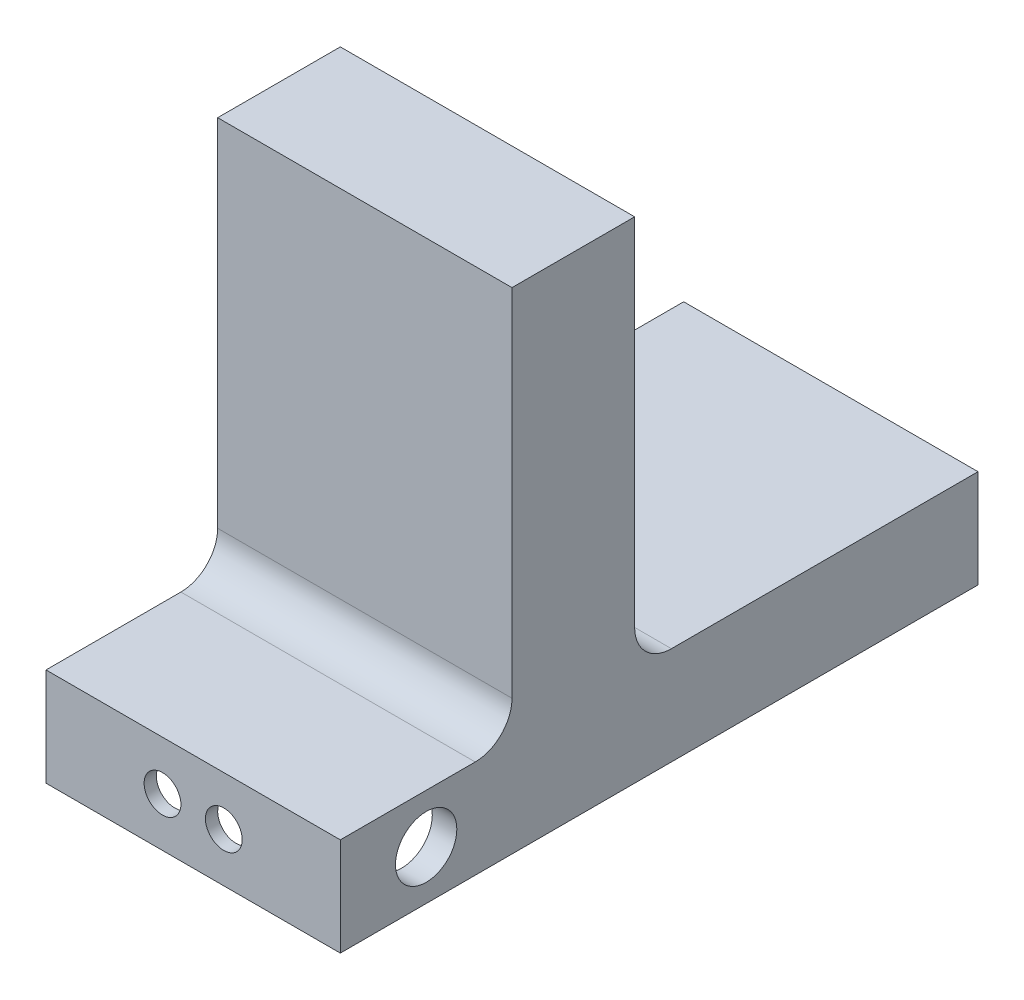
from build123d import *

# Parameters (mm, degrees)
ESQUISSE1_W                  = 120
ESQUISSE1_H                  = 200
BOSS_EXTRU_2_DEPTH           = 25
ESQUISSE3_W                  = 120
ESQUISSE3_H                  = 40
BOSS_EXTRU_3_DEPTH           = 70
CONG_1_R                     = 15
ESQUISSE4_W                  = 120
ESQUISSE4_H                  = 40
BOSS_EXTRU_4_DEPTH           = 140
CONG_2_R                     = 15
ESQUISSE5_W                  = 50
ESQUISSE5_H                  = 30
BOSS_EXTRU_9_DEPTH           = 7.5
ESQUISSE7_W                  = 100
ESQUISSE7_H                  = 80
ENL_V_MAT_EXTRU_1_DEPTH      = 35
ENL_V_MAT_EXTRU_7_REACH      = 351.285
ESQUISSE8_R                  = 7.5
ESQUISSE12_W                 = 50
ESQUISSE12_H                 = 30
ENL_V_MAT_EXTRU_8_DEPTH      = 5
ENL_V_MAT_EXTRU_9_DEPTH      = 286.700892543
ENL_V_MAT_EXTRU_9_DEPTH_BACK = 286.700892543
ESQUISSE13_R                 = 12.5
ESQUISSE14_W                 = 15
ESQUISSE14_H                 = 5
ENL_V_MAT_EXTRU_10_DEPTH     = 3


with BuildPart() as part:
    # Esquisse1 → Boss.-Extru.2 (new, symmetric)
    with BuildSketch(Plane.XY):
        with Locations((60, 100)):
            Rectangle(ESQUISSE1_W, ESQUISSE1_H)
    extrude(amount=BOSS_EXTRU_2_DEPTH, both=True)

    # Esquisse3 → Boss.-Extru.3 (add)
    with BuildSketch(Plane.XY.offset(25)):
        with Locations((60, 20)):
            Rectangle(ESQUISSE3_W, ESQUISSE3_H)
    extrude(amount=BOSS_EXTRU_3_DEPTH)

    # Congé1
    cong_1_edges = [part.edges().sort_by_distance(p)[0] for p in [
        (60, 40, 25),
    ]]
    fillet(cong_1_edges, radius=CONG_1_R)

    # Esquisse4 → Boss.-Extru.4 (add)
    with BuildSketch(Plane(origin=(0, 0, -25), x_dir=(-1, 0, 0), z_dir=(0, 0, -1))):
        with Locations((-60, 20)):
            Rectangle(ESQUISSE4_W, ESQUISSE4_H)
    extrude(amount=BOSS_EXTRU_4_DEPTH)

    # Congé2
    cong_2_edges = [part.edges().sort_by_distance(p)[0] for p in [
        (60, 40, -25),
    ]]
    fillet(cong_2_edges, radius=CONG_2_R)

    # Esquisse5 → Boss.-Extru.9 (add)
    with BuildSketch(Plane.XY.offset(95)):
        with Locations((60, 20)):
            Rectangle(ESQUISSE5_W, ESQUISSE5_H)
    extrude(amount=-BOSS_EXTRU_9_DEPTH)

    # Esquisse7 → Enlèv. mat.-Extru.1 (cut)
    with BuildSketch(Plane.XZ):
        with Locations((60, 45)):
            Rectangle(ESQUISSE7_W, ESQUISSE7_H)
    extrude(amount=-ENL_V_MAT_EXTRU_1_DEPTH, mode=Mode.SUBTRACT)

    # Esquisse8 → Enlèv. mat.-Extru.7 (cut, up to next)
    with BuildSketch(Plane.XY.offset(95), mode=Mode.PRIVATE) as enl_v_mat_extru_7_sk1:
        with Locations((47.5, 20)):
            Circle(ESQUISSE8_R)
    enl_v_mat_extru_7_tool1 = extrude(enl_v_mat_extru_7_sk1.sketch, amount=-ENL_V_MAT_EXTRU_7_REACH, mode=Mode.PRIVATE) & part.part
    # Esquisse8 → Enlèv. mat.-Extru.7 (cut, up to next)
    with BuildSketch(Plane.XY.offset(95), mode=Mode.PRIVATE) as enl_v_mat_extru_7_sk2:
        with Locations((72.5, 20)):
            Circle(ESQUISSE8_R)
    enl_v_mat_extru_7_tool2 = extrude(enl_v_mat_extru_7_sk2.sketch, amount=-ENL_V_MAT_EXTRU_7_REACH, mode=Mode.PRIVATE) & part.part
    add(enl_v_mat_extru_7_tool1.solids().sort_by_distance((47.5, 20, 95))[0], mode=Mode.SUBTRACT)
    add(enl_v_mat_extru_7_tool2.solids().sort_by_distance((72.5, 20, 95))[0], mode=Mode.SUBTRACT)

    # Esquisse12 → Enlèv. mat.-Extru.8 (cut)
    with BuildSketch(Plane(origin=(0, 0, 85), x_dir=(-1, 0, 0), z_dir=(0, 0, -1))):
        with Locations((-60, 20)):
            Rectangle(ESQUISSE12_W, ESQUISSE12_H)
    extrude(amount=-ENL_V_MAT_EXTRU_8_DEPTH, mode=Mode.SUBTRACT)

    # Esquisse13 → Enlèv. mat.-Extru.9 (cut, two sides: drawn at the far end of the back side and taken through both)
    with BuildSketch(Plane(origin=(120, 0, 0), x_dir=(0, 0, -1), z_dir=(1, 0, 0)).offset(-ENL_V_MAT_EXTRU_9_DEPTH_BACK)):
        with Locations((-60, 20)):
            Circle(ESQUISSE13_R)
    extrude(amount=ENL_V_MAT_EXTRU_9_DEPTH + ENL_V_MAT_EXTRU_9_DEPTH_BACK, mode=Mode.SUBTRACT)

    # Esquisse14 → Enlèv. mat.-Extru.10 (cut)
    with BuildSketch(Plane(origin=(0, 0, 85), x_dir=(-1, 0, 0), z_dir=(0, 0, -1))):
        with Locations((-60, 2.5)):
            Rectangle(ESQUISSE14_W, ESQUISSE14_H)
    extrude(amount=-ENL_V_MAT_EXTRU_10_DEPTH, mode=Mode.SUBTRACT)


solid = part.part
